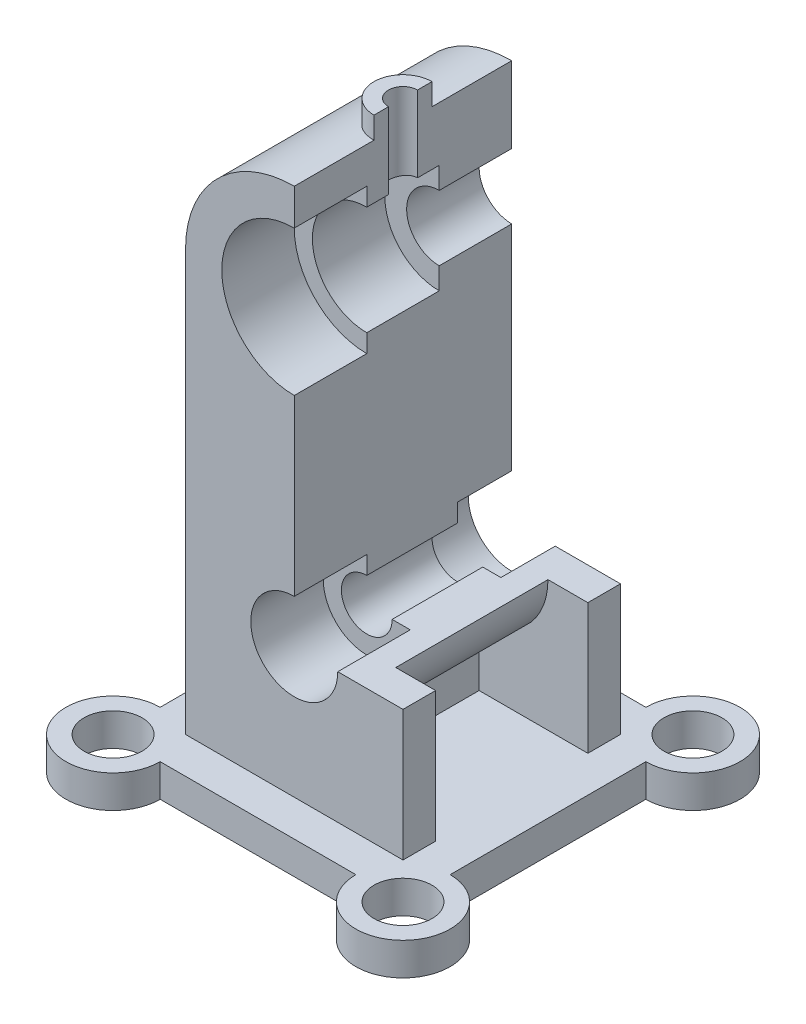
from build123d import *

# Parameters (mm, degrees)
SKETCH1_R           = 8
BOSS_EXTRUDE1_DEPTH = 9
SKETCH3_W           = 60
SKETCH3_H           = 116
BOSS_EXTRUDE2_DEPTH = 30
SKETCH4_R           = 30
BOSS_EXTRUDE3_DEPTH = 60
SKETCH6_R           = 8
SKETCH6_R_2         = 4
BOSS_EXTRUDE4_DEPTH = 20
SKETCH7_W           = 53.624772313
SKETCH7_H           = 116
CUT_EXTRUDE2_DEPTH  = 189.729965909
SKETCH8_R           = 12
CUT_EXTRUDE3_DEPTH  = 189.729965909
BOSS_EXTRUDE5_START = -25
BOSS_EXTRUDE5_DEPTH = 25
SKETCH10_R          = 20
CUT_EXTRUDE4_DEPTH  = 20
SKETCH11_R          = 15
CUT_EXTRUDE5_DEPTH  = 20
SKETCH12_R          = 9
CUT_EXTRUDE6_DEPTH  = 181.828648262
SKETCH13_R          = 4
CUT_EXTRUDE7_DEPTH  = 31
CUT_EXTRUDE8_DEPTH  = 42


with BuildPart() as part:
    # Sketch1 → Boss-Extrude1 (new body)
    with BuildSketch(Plane(origin=(0, 0, 0), x_dir=(1, 0, 0), z_dir=(0, 1, 0))):
        with BuildLine():
            Line((40, -27), (40, 27))
            ThreePointArc((40, 27), (49.192388155, 49.192388155), (27, 40))
            Line((27, 40), (-27, 40))
            ThreePointArc((-27, 40), (-49.192388155, 49.192388155), (-40, 27))
            Line((-40, 27), (-40, -27))
            ThreePointArc((-40, -27), (-49.192388155, -49.192388155), (-27, -40))
            Line((-27, -40), (27, -40))
            ThreePointArc((27, -40), (49.192388155, -49.192388155), (40, -27))
        make_face()
        with Locations(Location((-40, 40, 0), (0, 0, 270))):
            Circle(SKETCH1_R, mode=Mode.SUBTRACT)
        with Locations(Location((-40, -40, 0), (0, 0, 270))):
            Circle(SKETCH1_R, mode=Mode.SUBTRACT)
        with Locations(Location((40, -40, 0), (0, 0, 270))):
            Circle(SKETCH1_R, mode=Mode.SUBTRACT)
        with Locations(Location((40, 40, 0), (0, 0, 270))):
            Circle(SKETCH1_R, mode=Mode.SUBTRACT)
    extrude(amount=BOSS_EXTRUDE1_DEPTH)

    # Sketch3 → Boss-Extrude2 (add, symmetric)
    with BuildSketch(Plane(origin=(0, 0, 0), x_dir=(0, 0, -1), z_dir=(1, 0, 0))):
        with Locations((0, 67)):
            Rectangle(SKETCH3_W, SKETCH3_H)
    extrude(amount=BOSS_EXTRUDE2_DEPTH, both=True)

    # Sketch4 → Boss-Extrude3 (add)
    with BuildSketch(Plane.XY.offset(30)):
        with Locations((0, 125)):
            Circle(SKETCH4_R)
    extrude(amount=-BOSS_EXTRUDE3_DEPTH)

    # Sketch6 → Boss-Extrude4 (add)
    with BuildSketch(Plane(origin=(0, 161, 0), x_dir=(1, 0, 0), z_dir=(0, 1, 0))):
        with Locations(Location((0, 0, 0), (0, 0, 270))):
            Circle(SKETCH6_R)
        with Locations(Location((0, 0, 0), (0, 0, 270))):
            Circle(SKETCH6_R_2, mode=Mode.SUBTRACT)
    extrude(amount=-BOSS_EXTRUDE4_DEPTH)

    # Sketch7 → Cut-Extrude2 (cut, through all)
    with BuildSketch(Plane.XY.offset(30)):
        with Locations((26.812386157, 103)):
            Rectangle(SKETCH7_W, SKETCH7_H)
    extrude(amount=-CUT_EXTRUDE2_DEPTH, mode=Mode.SUBTRACT)

    # Sketch8 → Cut-Extrude3 (cut, through all)
    with BuildSketch(Plane.XY.offset(30)):
        with Locations((0, 45)):
            Circle(SKETCH8_R)
    extrude(amount=-CUT_EXTRUDE3_DEPTH, mode=Mode.SUBTRACT)

    # Sketch9 → Boss-Extrude5 (add)
    with BuildSketch(Plane(origin=(0, 0, -15), x_dir=(-1, 0, 0), z_dir=(0, 0, -1)).offset(BOSS_EXTRUDE5_START)):
        with BuildLine():
            Line((-12, 45), (-7, 45))
            ThreePointArc((-7, 45), (4.949747468, 40.050252532), (0, 52))
            Line((0, 52), (0, 57))
            ThreePointArc((0, 57), (8.485281374, 36.514718626), (-12, 45))
        make_face()
    extrude(amount=BOSS_EXTRUDE5_DEPTH)

    # Sketch10 → Cut-Extrude4 (cut)
    with BuildSketch(Plane.XY.offset(30)):
        with Locations((0, 125)):
            Circle(SKETCH10_R)
    extrude(amount=-CUT_EXTRUDE4_DEPTH, mode=Mode.SUBTRACT)

    # Sketch11 → Cut-Extrude5 (cut)
    with BuildSketch(Plane.XY.offset(10)):
        with Locations((0, 125)):
            Circle(SKETCH11_R)
    extrude(amount=-CUT_EXTRUDE5_DEPTH, mode=Mode.SUBTRACT)

    # Sketch12 → Cut-Extrude6 (cut, through all)
    with BuildSketch(Plane.XY.offset(-10)):
        with Locations((0, 125)):
            Circle(SKETCH12_R)
    extrude(amount=-CUT_EXTRUDE6_DEPTH, mode=Mode.SUBTRACT)

    # Sketch13 → Cut-Extrude7 (cut)
    with BuildSketch(Plane(origin=(0, 161, 0), x_dir=(1, 0, 0), z_dir=(0, 1, 0))):
        Circle(SKETCH13_R)
    extrude(amount=-CUT_EXTRUDE7_DEPTH, mode=Mode.SUBTRACT)

    # Sketch14 → Cut-Extrude8 (cut)
    with BuildSketch(Plane.XY.offset(21)):
        with BuildLine():
            Line((19, 45), (30, 45))
            Line((30, 45), (30, 9))
            Line((30, 9), (0, 9))
            Line((0, 9), (0, 26))
            ThreePointArc((0, 26), (13.435028843, 31.564971157), (19, 45))
        make_face()
    extrude(amount=-CUT_EXTRUDE8_DEPTH, mode=Mode.SUBTRACT)


solid = part.part
